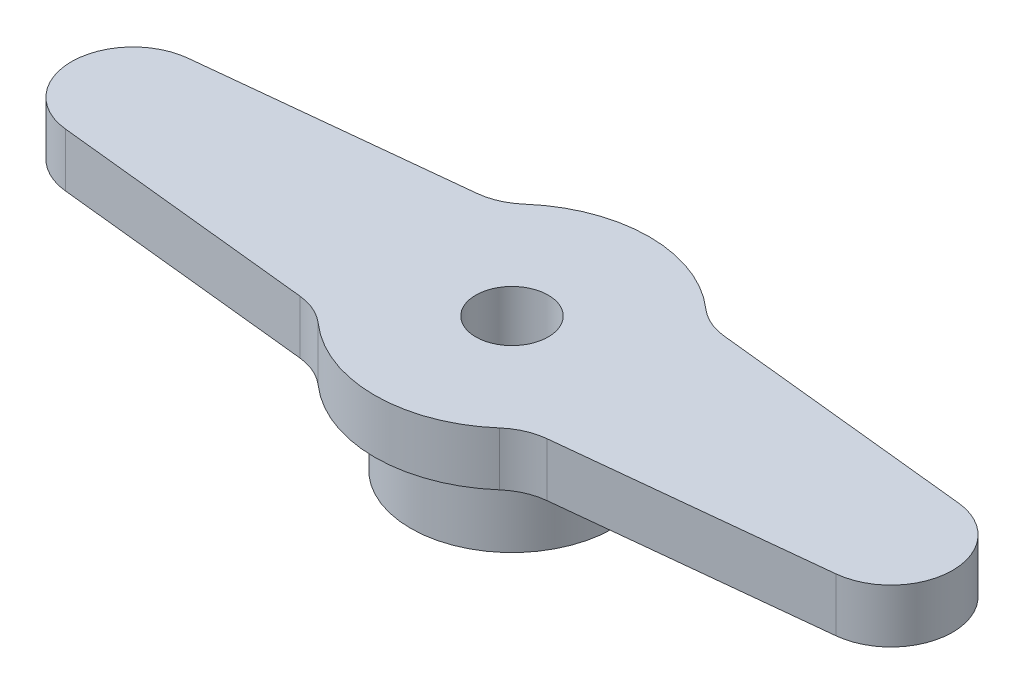
from build123d import *

# Parameters (mm, degrees)
SKETCH1_R           = 4.3688
SKETCH1_R_2         = 3.048
BOSS_EXTRUDE1_DEPTH = 3.429
BOSS_EXTRUDE2_DEPTH = 2.3114
SKETCH3_R           = 1.5621
CUT_EXTRUDE1_DEPTH  = 21.699383219


with BuildPart() as part:
    # Sketch1 → Boss-Extrude1 (new body)
    with BuildSketch(Plane(origin=(0, 0, 0), x_dir=(1, 0, 0), z_dir=(0, 1, 0))):
        with Locations(Location((0, 0, 0), (0, 0, 270))):
            Circle(SKETCH1_R)
        with Locations(Location((0, 0, 0), (0, 0, 270))):
            Circle(SKETCH1_R_2, mode=Mode.SUBTRACT)
    extrude(amount=BOSS_EXTRUDE1_DEPTH)

    # Sketch2 → Boss-Extrude2 (add)
    with BuildSketch(Plane(origin=(0, 3.429, 0), x_dir=(1, 0, 0), z_dir=(0, 1, 0))):
        with BuildLine():
            Line((5.322708788, 3.823825598), (16.607191493, 2.6416))
            ThreePointArc((16.607191493, 2.6416), (18.9865, 0), (16.607191493, -2.6416))
            Line((16.607191493, -2.6416), (5.322708788, -3.823825598))
            ThreePointArc((5.322708788, -3.823825598), (4.567932808, -4.023552477), (3.909477587, -4.443093093))
            ThreePointArc((3.909477587, -4.443093093), (0, -5.9182), (-3.909477587, -4.443093093))
            ThreePointArc((-3.909477587, -4.443093093), (-4.567932808, -4.023552477), (-5.322708788, -3.823825598))
            Line((-5.322708788, -3.823825598), (-16.607191493, -2.6416))
            ThreePointArc((-16.607191493, -2.6416), (-18.9865, 0), (-16.607191493, 2.6416))
            Line((-16.607191493, 2.6416), (-5.322708788, 3.823825598))
            ThreePointArc((-5.322708788, 3.823825598), (-4.567932808, 4.023552477), (-3.909477587, 4.443093093))
            ThreePointArc((-3.909477587, 4.443093093), (0, 5.9182), (3.909477587, 4.443093093))
            ThreePointArc((3.909477587, 4.443093093), (4.567932808, 4.023552477), (5.322708788, 3.823825598))
        make_face()
    extrude(amount=BOSS_EXTRUDE2_DEPTH)

    # Sketch3 → Cut-Extrude1 (cut, through all)
    with BuildSketch(Plane(origin=(0, 5.7404, 0), x_dir=(1, 0, 0), z_dir=(0, 1, 0))):
        with Locations(Location((0, 0, 0), (0, 0, 270))):
            Circle(SKETCH3_R)
    extrude(amount=-CUT_EXTRUDE1_DEPTH, mode=Mode.SUBTRACT)


solid = part.part
